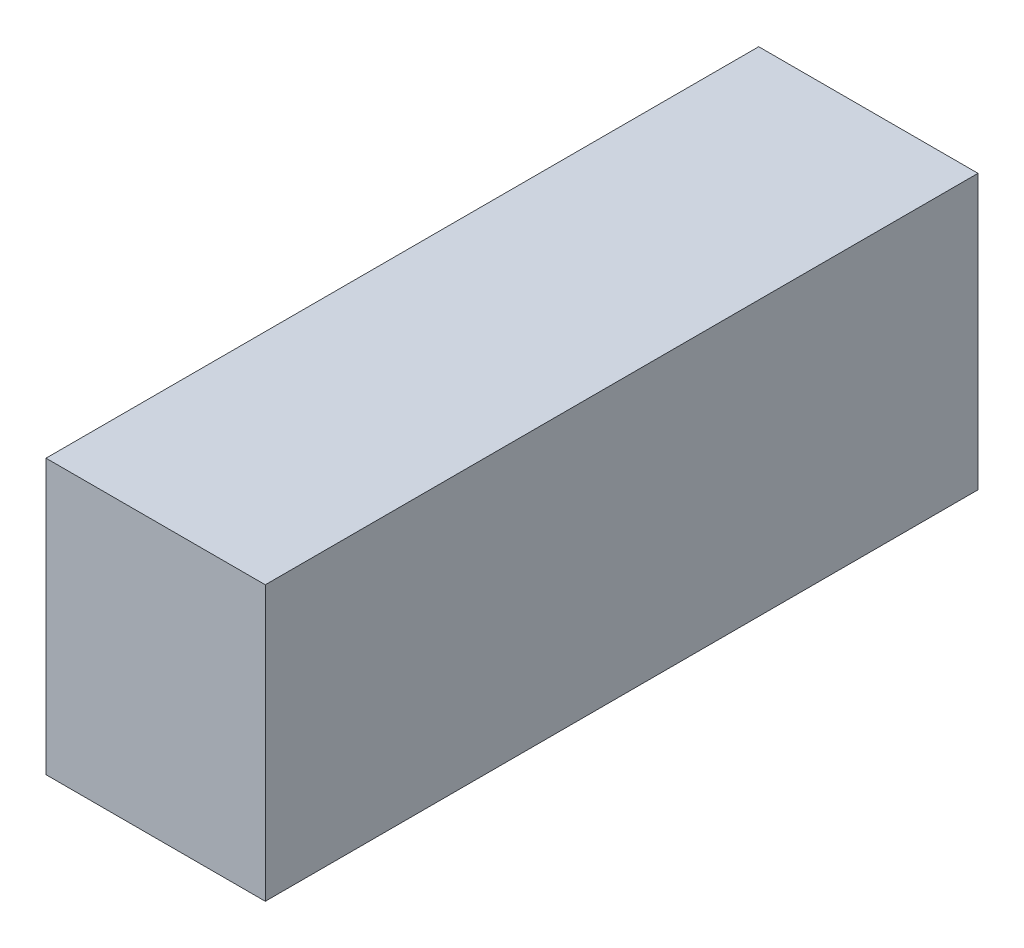
from build123d import *

# Parameters (mm, degrees)
SKETCH1_W           = 35.56
SKETCH1_H           = 44.45
BOSS_EXTRUDE1_DEPTH = 115.57


with BuildPart() as part:
    # Sketch1 → Boss-Extrude1 (new body)
    with BuildSketch(Plane.XY):
        with Locations((1.736265261, -6.168437491)):
            Rectangle(SKETCH1_W, SKETCH1_H)
    extrude(amount=BOSS_EXTRUDE1_DEPTH)


solid = part.part
